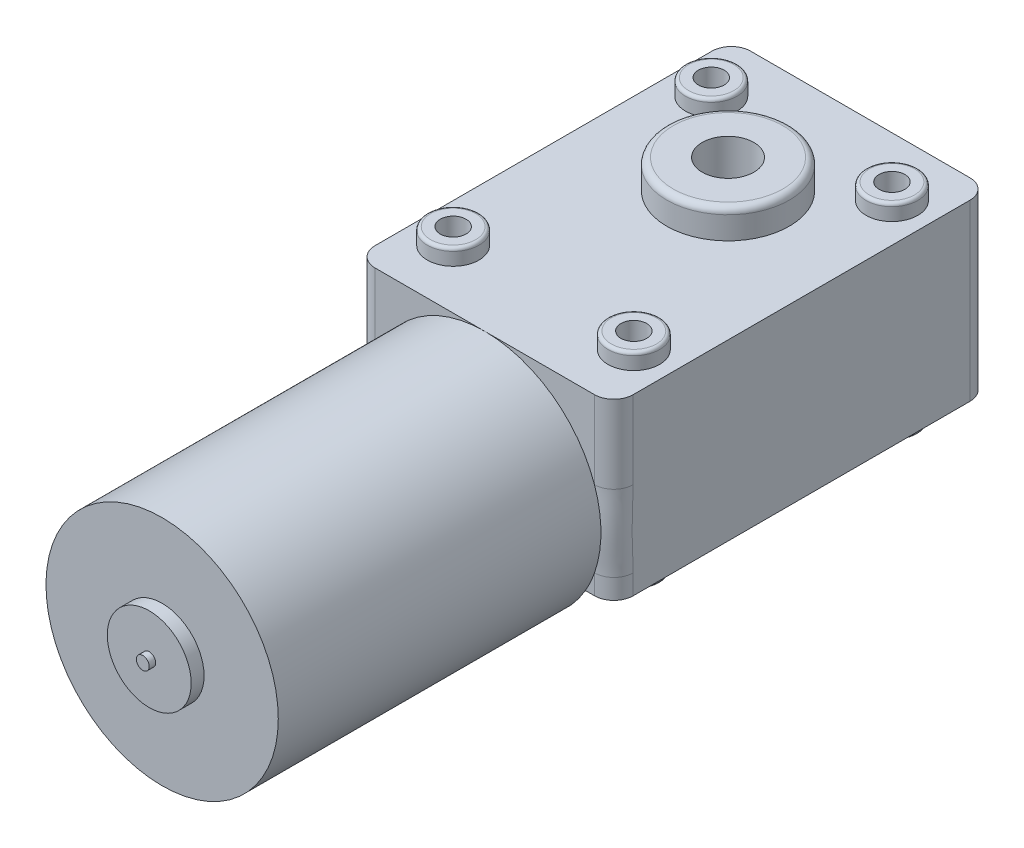
from build123d import *

# Parameters (mm, degrees)
SKETCH1_W           = 40
SKETCH1_H           = 58.2
SKETCH1_R           = 2
SKETCH1_R_2         = 4
BOSS_EXTRUDE1_DEPTH = 27
SKETCH2_R           = 9.5
SKETCH2_R_2         = 4
BOSS_EXTRUDE2_DEPTH = 4.5
BOSS_EXTRUDE3_START = 4.5
SKETCH3_R           = 9.5
SKETCH3_R_2         = 4
BOSS_EXTRUDE3_DEPTH = 4.5
SKETCH4_R           = 4
SKETCH4_R_2         = 2
BOSS_EXTRUDE4_DEPTH = 2.5
BOSS_EXTRUDE5_START = 2.5
SKETCH5_R           = 4
SKETCH5_R_2         = 2
BOSS_EXTRUDE5_DEPTH = 2.5
SKETCH6_R           = 18
BOSS_EXTRUDE6_DEPTH = 50
SKETCH7_R           = 6.5
BOSS_EXTRUDE7_DEPTH = 2
SKETCH8_R           = 1
BOSS_EXTRUDE8_DEPTH = 1
FILLET1_R           = 3
FILLET2_R           = 1
FILLET3_R           = 0.5


with BuildPart() as part:
    # Sketch1 → Boss-Extrude1 (new body)
    with BuildSketch(Plane(origin=(0, 0, 0), x_dir=(1, 0, 0), z_dir=(0, 1, 0))):
        Rectangle(SKETCH1_W, SKETCH1_H)
        with Locations(Location((-14, 20, 0), (0, 0, 270))):
            Circle(SKETCH1_R, mode=Mode.SUBTRACT)
        with Locations(Location((14, 20, 0), (0, 0, 270))):
            Circle(SKETCH1_R, mode=Mode.SUBTRACT)
        with Locations(Location((14, -20, 0), (0, 0, 270))):
            Circle(SKETCH1_R, mode=Mode.SUBTRACT)
        with Locations(Location((-14, -20, 0), (0, 0, 270))):
            Circle(SKETCH1_R, mode=Mode.SUBTRACT)
        with Locations(Location((0, 8.6, 0), (0, 0, 270))):
            Circle(SKETCH1_R_2, mode=Mode.SUBTRACT)
    extrude(amount=BOSS_EXTRUDE1_DEPTH)

    # Sketch2 → Boss-Extrude2 (add)
    with BuildSketch(Plane(origin=(0, 27, 0), x_dir=(1, 0, 0), z_dir=(0, 1, 0))):
        with Locations(Location((0, 8.6, 0), (0, 0, 270))):
            Circle(SKETCH2_R)
        with Locations(Location((0, 8.6, 0), (0, 0, 270))):
            Circle(SKETCH2_R_2, mode=Mode.SUBTRACT)
    extrude(amount=BOSS_EXTRUDE2_DEPTH)

    # Sketch3 → Boss-Extrude3 (add)
    with BuildSketch(Plane.XZ.offset(BOSS_EXTRUDE3_START)):
        with Locations(Location((0, -8.6, 0), (0, 0, 90))):
            Circle(SKETCH3_R)
        with Locations(Location((0, -8.6, 0), (0, 0, 270))):
            Circle(SKETCH3_R_2, mode=Mode.SUBTRACT)
    extrude(amount=-BOSS_EXTRUDE3_DEPTH)

    # Sketch4 → Boss-Extrude4 (add)
    # profile 1 of 4: a face of its own
    with BuildSketch(Plane(origin=(0, 27, 0), x_dir=(1, 0, 0), z_dir=(0, 1, 0))):
        with Locations(Location((-14, 20, 0), (0, 0, 270))):
            Circle(SKETCH4_R)
        with Locations(Location((-14, 20, 0), (0, 0, 270))):
            Circle(SKETCH4_R_2, mode=Mode.SUBTRACT)
    # profile 2 of 4: a face of its own
    with BuildSketch(Plane(origin=(0, 27, 0), x_dir=(1, 0, 0), z_dir=(0, 1, 0))):
        with Locations(Location((-14, -20, 0), (0, 0, 90))):
            Circle(SKETCH4_R)
        with Locations(Location((-14, -20, 0), (0, 0, 90))):
            Circle(SKETCH4_R_2, mode=Mode.SUBTRACT)
    # profile 3 of 4: a face of its own
    with BuildSketch(Plane(origin=(0, 27, 0), x_dir=(1, 0, 0), z_dir=(0, 1, 0))):
        with Locations(Location((14, -20, 0), (0, 0, 270))):
            Circle(SKETCH4_R)
        with Locations(Location((14, -20, 0), (0, 0, 270))):
            Circle(SKETCH4_R_2, mode=Mode.SUBTRACT)
    # profile 4 of 4: a face of its own
    with BuildSketch(Plane(origin=(0, 27, 0), x_dir=(1, 0, 0), z_dir=(0, 1, 0))):
        with Locations(Location((14, 20, 0), (0, 0, 90))):
            Circle(SKETCH4_R)
        with Locations(Location((14, 20, 0), (0, 0, 90))):
            Circle(SKETCH4_R_2, mode=Mode.SUBTRACT)
    extrude(amount=BOSS_EXTRUDE4_DEPTH)

    # Sketch5 → Boss-Extrude5 (add)
    # profile 1 of 4: a face of its own
    with BuildSketch(Plane.XZ.offset(BOSS_EXTRUDE5_START)):
        with Locations(Location((-14, 20, 0), (0, 0, 270))):
            Circle(SKETCH5_R)
        with Locations(Location((-14, 20, 0), (0, 0, 270))):
            Circle(SKETCH5_R_2, mode=Mode.SUBTRACT)
    # profile 2 of 4: a face of its own
    with BuildSketch(Plane.XZ.offset(BOSS_EXTRUDE5_START)):
        with Locations(Location((14, 20, 0), (0, 0, 90))):
            Circle(SKETCH5_R)
        with Locations(Location((14, 20, 0), (0, 0, 90))):
            Circle(SKETCH5_R_2, mode=Mode.SUBTRACT)
    # profile 3 of 4: a face of its own
    with BuildSketch(Plane.XZ.offset(BOSS_EXTRUDE5_START)):
        with Locations(Location((14, -20, 0), (0, 0, 270))):
            Circle(SKETCH5_R)
        with Locations(Location((14, -20, 0), (0, 0, 270))):
            Circle(SKETCH5_R_2, mode=Mode.SUBTRACT)
    # profile 4 of 4: a face of its own
    with BuildSketch(Plane.XZ.offset(BOSS_EXTRUDE5_START)):
        with Locations(Location((-14, -20, 0), (0, 0, 90))):
            Circle(SKETCH5_R)
        with Locations(Location((-14, -20, 0), (0, 0, 90))):
            Circle(SKETCH5_R_2, mode=Mode.SUBTRACT)
    extrude(amount=-BOSS_EXTRUDE5_DEPTH)

    # Sketch6 → Boss-Extrude6 (add)
    with BuildSketch(Plane.XY.offset(29.1)):
        with Locations(Location((0, 9, 0), (0, 0, 210))):
            Circle(SKETCH6_R)
    extrude(amount=BOSS_EXTRUDE6_DEPTH)

    # Sketch7 → Boss-Extrude7 (add)
    with BuildSketch(Plane.XY.offset(79.1)):
        with Locations((0, 9)):
            Circle(SKETCH7_R)
    extrude(amount=BOSS_EXTRUDE7_DEPTH)

    # Sketch8 → Boss-Extrude8 (add)
    with BuildSketch(Plane.XY.offset(81.1)):
        with Locations((0, 9)):
            Circle(SKETCH8_R)
    extrude(amount=BOSS_EXTRUDE8_DEPTH)

    # Fillet1
    fillet1_edges = [part.edges().sort_by_distance(p)[0] for p in [
        (20, 13.5, 29.1),
        (-20, 13.5, 29.1),
        (-20, 13.5, -29.1),
        (20, 13.5, -29.1),
    ]]
    fillet(fillet1_edges, radius=FILLET1_R)

    # Fillet2
    fillet2_edges = [part.edges().sort_by_distance(p)[0] for p in [
        (0, 31.5, -18.1),
        (0, -4.5, -18.1),
    ]]
    fillet(fillet2_edges, radius=FILLET2_R)

    # Fillet3
    fillet3_edges = [part.edges().sort_by_distance(p)[0] for p in [
        (-14, 29.5, -24),
        (-14, 29.5, 24),
        (14, 29.5, 16),
        (14, 29.5, -16),
        (-14, -2.5, 24),
        (14, -2.5, 16),
        (14, -2.5, -16),
        (-14, -2.5, -24),
    ]]
    fillet(fillet3_edges, radius=FILLET3_R)


solid = part.part
